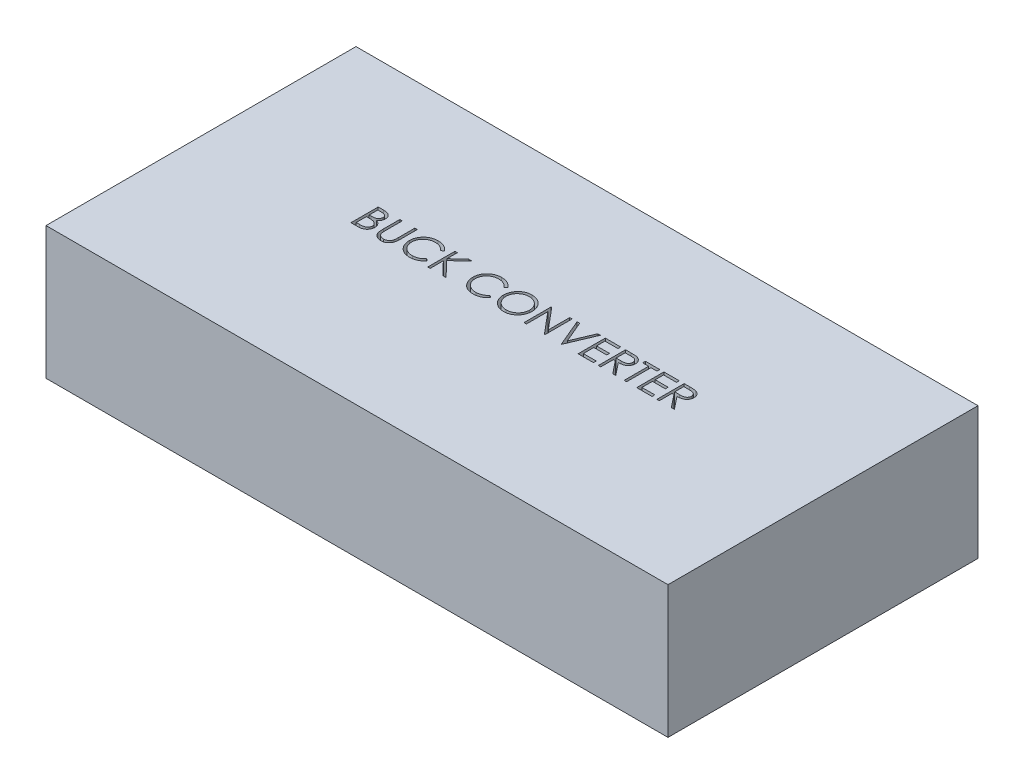
from build123d import *

# Parameters (mm, degrees)
SKETCH1_W           = 80.01
SKETCH1_H           = 39.878
BOSS_EXTRUDE1_DEPTH = 17.018
CUT_EXTRUDE2_DEPTH  = 12.7


with BuildPart() as part:
    # Sketch1 → Boss-Extrude1 (new body)
    with BuildSketch(Plane(origin=(0, 0, 0), x_dir=(1, 0, 0), z_dir=(0, 1, 0))):
        Rectangle(SKETCH1_W, SKETCH1_H)
    extrude(amount=BOSS_EXTRUDE1_DEPTH)

    # Sketch4 → Cut-Extrude2 (cut)
    # profile 1 of 13: a face of its own
    with BuildSketch(Plane(origin=(0, 17.018, 0), x_dir=(1, 0, 0), z_dir=(0, 1, 0))):
        with BuildLine():
            Line((-20.708333333, 3.5), (-20.025440705, 3.5))
            add(Edge.make_bspline(
                [(-20.025440705, 3.5), (-19.992012227, 3.49982425), (-19.927219517, 3.499483602), (-19.833000075, 3.49420047), (-19.744751264, 3.486996801), (-19.662447492, 3.475566708), (-19.586126789, 3.461774931), (-19.515559152, 3.445073115), (-19.45096898, 3.425046501), (-19.373856243, 3.39320022), (-19.285935583, 3.345877051), (-19.19073719, 3.275948486), (-19.109332951, 3.190416023), (-19.039146633, 3.093933368), (-18.983345514, 2.987797596), (-18.942976216, 2.874538407), (-18.917418341, 2.755616665), (-18.914789907, 2.673973487), (-18.913461538, 2.63271234)],
                knots=[0, 0, 0, 0, 1.001505555, 1.941167018, 2.826882275, 3.653841531, 4.429895133, 5.150066043, 5.825578002, 6.45369114, 7.647487171, 8.808567382, 9.977351308, 11.170798116, 12.373658725, 13.556498008, 14.765093433, 16, 16, 16, 16], degree=3))
            add(Edge.make_bspline(
                [(-18.913461538, 2.63271234), (-18.914554757, 2.594059784), (-18.916703034, 2.518103867), (-18.937245794, 2.407009758), (-18.969406462, 2.301258539), (-19.014111711, 2.201236154), (-19.072213707, 2.10920254), (-19.141072026, 2.024415274), (-19.224148829, 1.950464217), (-19.286392069, 1.909121315), (-19.318008814, 1.888120994)],
                knots=[0, 0, 0, 0, 1.044552857, 2.05264487, 3.044412934, 4.028983338, 5.005914585, 5.980388656, 6.974128949, 8, 8, 8, 8], degree=3))
            add(Edge.make_bspline(
                [(-19.318008814, 1.888120994), (-19.278248387, 1.872855995), (-19.202176839, 1.84365027), (-19.097490827, 1.792014806), (-19.007295982, 1.735852696), (-18.930898836, 1.674520846), (-18.865561181, 1.608412035), (-18.808508239, 1.536556921), (-18.759826865, 1.458018163), (-18.718113941, 1.373614627), (-18.685565185, 1.284208159), (-18.661189281, 1.190637383), (-18.647221832, 1.093237828), (-18.645234191, 1.026952448), (-18.644230769, 0.993489583)],
                knots=[0, 0, 0, 0, 1.27268992, 2.434971085, 3.483601985, 4.442670788, 5.356604649, 6.2567628, 7.179492994, 8.113709626, 9.066344395, 10.018646069, 10.999752585, 12, 12, 12, 12], degree=3))
            add(Edge.make_bspline(
                [(-18.644230769, 0.993489583), (-18.645207615, 0.959322711), (-18.647129587, 0.892098433), (-18.661309559, 0.793343299), (-18.685318666, 0.698968352), (-18.718389812, 0.608363169), (-18.761552127, 0.521703035), (-18.814080091, 0.438889771), (-18.876711655, 0.36075544), (-18.946774524, 0.286431817), (-19.026036669, 0.21960403), (-19.111552424, 0.160088323), (-19.204398744, 0.111142261), (-19.303050738, 0.070026239), (-19.408615054, 0.038619041), (-19.520617662, 0.016646467), (-19.638961963, 0.00184143), (-19.720171715, 0.000624225), (-19.76181891, 0)],
                knots=[0, 0, 0, 0, 0.978564426, 1.925352924, 2.850884081, 3.763762016, 4.682927383, 5.618979971, 6.567305752, 7.547517671, 8.540179244, 9.531824382, 10.526200242, 11.540722885, 12.589160233, 13.674978461, 14.80764778, 16, 16, 16, 16], degree=3))
            Line((-19.76181891, 0), (-20.708333333, 0))
            Line((-20.708333333, 0), (-20.708333333, 3.5))
        make_face()
        with BuildLine():
            Line((-20.394230769, 3.141025641), (-20.394230769, 2.019230769))
            Line((-20.394230769, 2.019230769), (-20.183193109, 2.019230769))
            add(Edge.make_bspline(
                [(-20.183193109, 2.019230769), (-20.152344314, 2.019630692), (-20.092738154, 2.020403425), (-20.006418258, 2.022616942), (-19.92629324, 2.028814985), (-19.852501407, 2.035011248), (-19.785158963, 2.045085835), (-19.724415101, 2.057077958), (-19.669316504, 2.069760863), (-19.605776959, 2.09133035), (-19.53370401, 2.123208025), (-19.456870906, 2.172679861), (-19.389136436, 2.231604215), (-19.331939249, 2.299595176), (-19.285127778, 2.374461362), (-19.252614063, 2.455008243), (-19.230566779, 2.539228375), (-19.228575247, 2.597046627), (-19.227564103, 2.626402244)],
                knots=[0, 0, 0, 0, 1.156816544, 2.235205308, 3.236616184, 4.169592532, 5.011045266, 5.787822928, 6.49130361, 7.128639758, 8.301311294, 9.436451833, 10.541879658, 11.654887649, 12.756523258, 13.837046038, 14.901820046, 16, 16, 16, 16], degree=3))
            add(Edge.make_bspline(
                [(-19.227564103, 2.626402244), (-19.228090283, 2.645828015), (-19.229122443, 2.683933787), (-19.237575745, 2.739483141), (-19.25194332, 2.791726894), (-19.270397613, 2.841381004), (-19.296186302, 2.886892854), (-19.326549765, 2.92983605), (-19.363235455, 2.968748169), (-19.404992768, 3.005117667), (-19.453001391, 3.037362195), (-19.507232683, 3.065602958), (-19.56842036, 3.088343735), (-19.635533215, 3.108259887), (-19.709604302, 3.122248181), (-19.789778856, 3.133901569), (-19.876713575, 3.139834311), (-19.936858677, 3.140619673), (-19.967948718, 3.141025641)],
                knots=[0, 0, 0, 0, 0.91205012, 1.789085906, 2.630437955, 3.453916878, 4.269457761, 5.079663411, 5.91843418, 6.774407191, 7.675494373, 8.627863946, 9.638891023, 10.736472738, 11.911756761, 13.175263542, 14.539845004, 16, 16, 16, 16], degree=3))
            Line((-19.967948718, 3.141025641), (-20.394230769, 3.141025641))
        make_face(mode=Mode.SUBTRACT)
        with BuildLine():
            Line((-20.394230769, 1.66025641), (-20.394230769, 0.358974359))
            Line((-20.394230769, 0.358974359), (-19.946915064, 0.358974359))
            add(Edge.make_bspline(
                [(-19.946915064, 0.358974359), (-19.914896138, 0.359358106), (-19.85318388, 0.360097729), (-19.764082649, 0.362512283), (-19.681499546, 0.368004559), (-19.60581141, 0.376650409), (-19.536200957, 0.386028858), (-19.473503254, 0.398640139), (-19.417210061, 0.413089099), (-19.351935753, 0.435423272), (-19.278432245, 0.470119743), (-19.199221388, 0.522433969), (-19.12879517, 0.584757277), (-19.068989911, 0.656888191), (-19.019976923, 0.735319518), (-18.984321467, 0.818464868), (-18.962330611, 0.904950395), (-18.959668441, 0.963917108), (-18.958333333, 0.993489583)],
                knots=[0, 0, 0, 0, 1.160039823, 2.235823828, 3.228722157, 4.157150951, 4.99529583, 5.772374946, 6.472645482, 7.099169577, 8.269452708, 9.405989375, 10.527446681, 11.663510218, 12.788923519, 13.866172445, 14.929861265, 16, 16, 16, 16], degree=3))
            add(Edge.make_bspline(
                [(-18.958333333, 0.993489583), (-18.958609438, 1.011982924), (-18.959157193, 1.048671306), (-18.967417808, 1.102587125), (-18.979431677, 1.154812998), (-18.994963111, 1.205490739), (-19.017582578, 1.253704115), (-19.043989123, 1.300406674), (-19.074950525, 1.345660154), (-19.123194691, 1.402872407), (-19.193366675, 1.46878942), (-19.293073451, 1.533326923), (-19.406445749, 1.58537473), (-19.488673242, 1.607474206), (-19.53114984, 1.618890224)],
                knots=[0, 0, 0, 0, 0.723448775, 1.435228256, 2.130040452, 2.821711965, 3.505591119, 4.210454504, 4.921174351, 5.648778258, 7.137944449, 8.670945889, 10.280296675, 12, 12, 12, 12], degree=3))
            add(Edge.make_bspline(
                [(-19.53114984, 1.618890224), (-19.548178936, 1.622345308), (-19.585101528, 1.629836643), (-19.645309108, 1.637744346), (-19.714044977, 1.644789406), (-19.791467855, 1.650000564), (-19.877675696, 1.655387107), (-19.972852614, 1.657481929), (-20.076609929, 1.659981189), (-20.148602301, 1.660162323), (-20.185997596, 1.66025641)],
                knots=[0, 0, 0, 0, 0.634451884, 1.375622551, 2.216452059, 3.157844607, 4.20941857, 5.370758133, 6.634282058, 8, 8, 8, 8], degree=3))
            Line((-20.185997596, 1.66025641), (-20.394230769, 1.66025641))
        make_face(mode=Mode.SUBTRACT)
    # profile 2 of 13: a face of its own
    with BuildSketch(Plane(origin=(0, 17.018, 0), x_dir=(1, 0, 0), z_dir=(0, 1, 0))):
        with BuildLine():
            Line((-17.926282051, 3.5), (-17.612179487, 3.5))
            Line((-17.612179487, 3.5), (-17.612179487, 1.402944712))
            add(Edge.make_bspline(
                [(-17.612179487, 1.402944712), (-17.612226231, 1.373263976), (-17.612314936, 1.316939665), (-17.611722422, 1.236771364), (-17.610063054, 1.165498905), (-17.609016894, 1.102847558), (-17.606689561, 1.04910481), (-17.604791514, 1.0039795), (-17.602350957, 0.967685297), (-17.599417839, 0.946504371), (-17.598157051, 0.93739984)],
                knots=[0, 0, 0, 0, 1.528628734, 2.90083645, 4.128790002, 5.200304208, 6.127813768, 6.898992206, 7.526736466, 8, 8, 8, 8], degree=3))
            add(Edge.make_bspline(
                [(-17.598157051, 0.93739984), (-17.592979592, 0.904553076), (-17.582916406, 0.840710347), (-17.557270028, 0.749802065), (-17.521452527, 0.667870607), (-17.479009485, 0.592359316), (-17.423076873, 0.525369956), (-17.356073338, 0.463658303), (-17.274895569, 0.409686499), (-17.184634964, 0.360335687), (-17.087349726, 0.320670604), (-16.98793846, 0.29067724), (-16.887895481, 0.27239834), (-16.820919316, 0.270281801), (-16.787660256, 0.269230769)],
                knots=[0, 0, 0, 0, 1.035780045, 2.013197591, 2.933192213, 3.817615948, 4.702609284, 5.640816605, 6.646850145, 7.73207398, 8.84249596, 9.914020372, 10.964143139, 12, 12, 12, 12], degree=3))
            add(Edge.make_bspline(
                [(-16.787660256, 0.269230769), (-16.759106516, 0.27030462), (-16.702163954, 0.272446118), (-16.617557523, 0.285707549), (-16.535157415, 0.309608115), (-16.454556735, 0.340447873), (-16.37900575, 0.381195464), (-16.308462308, 0.428266303), (-16.245498374, 0.48347718), (-16.188040376, 0.544577524), (-16.138005441, 0.613517324), (-16.094634299, 0.688795462), (-16.059108369, 0.771544809), (-16.041564844, 0.829699231), (-16.032552083, 0.859575321)],
                knots=[0, 0, 0, 0, 0.994687771, 1.983630487, 2.973142513, 3.978332533, 4.983357753, 5.956394766, 6.925816176, 7.893390482, 8.871859704, 9.88551698, 10.913711441, 12, 12, 12, 12], degree=3))
            add(Edge.make_bspline(
                [(-16.032552083, 0.859575321), (-16.029551958, 0.871923895), (-16.02286647, 0.899441495), (-16.016619425, 0.945962785), (-16.010112899, 1.000852149), (-16.005598329, 1.064503962), (-16.001197109, 1.136704935), (-15.998564036, 1.217831192), (-15.997347003, 1.307588153), (-15.996984323, 1.370225315), (-15.996794872, 1.402944712)],
                knots=[0, 0, 0, 0, 0.558680831, 1.244966039, 2.062412453, 2.990489873, 4.051219941, 5.244515665, 6.560634259, 8, 8, 8, 8], degree=3))
            Line((-15.996794872, 1.402944712), (-15.996794872, 3.5))
            Line((-15.996794872, 3.5), (-15.682692308, 3.5))
            Line((-15.682692308, 3.5), (-15.682692308, 1.386117788))
            add(Edge.make_bspline(
                [(-15.682692308, 1.386117788), (-15.682946428, 1.34801941), (-15.683442359, 1.273668107), (-15.687742936, 1.164716748), (-15.694599936, 1.061363766), (-15.704288024, 0.96359527), (-15.717125027, 0.871761111), (-15.731400247, 0.785056342), (-15.749579781, 0.70410335), (-15.770813182, 0.628270932), (-15.79508673, 0.556085419), (-15.826527878, 0.487576804), (-15.861952378, 0.420662404), (-15.903967031, 0.356354295), (-15.951178414, 0.294367742), (-16.004630094, 0.235078667), (-16.062554255, 0.177539621), (-16.125913815, 0.123226555), (-16.19366434, 0.073417878), (-16.265604298, 0.029620107), (-16.341181067, -0.007403511), (-16.420198194, -0.037879435), (-16.502689396, -0.060794034), (-16.588656756, -0.07786919), (-16.67829595, -0.087571487), (-16.739260606, -0.089013418), (-16.770132212, -0.08974359)],
                knots=[0, 0, 0, 0, 1.316592851, 2.569410997, 3.76748051, 4.895814652, 5.963796859, 6.97159953, 7.931736103, 8.829262218, 9.692595152, 10.560224239, 11.431080259, 12.30701507, 13.211635791, 14.121146779, 15.063487852, 16.031507147, 17.00238618, 17.966455255, 18.938106653, 19.907068911, 20.888905087, 21.893141452, 22.933117798, 24, 24, 24, 24], degree=3))
            add(Edge.make_bspline(
                [(-16.770132212, -0.08974359), (-16.803801314, -0.088958824), (-16.869859973, -0.087419118), (-16.96719804, -0.078596368), (-17.060512237, -0.061977973), (-17.150788114, -0.04081803), (-17.236796611, -0.011634292), (-17.319690055, 0.022463832), (-17.398048736, 0.064341093), (-17.473143865, 0.110934486), (-17.542968621, 0.163359124), (-17.607066024, 0.220499298), (-17.665541895, 0.281439675), (-17.717410591, 0.346840041), (-17.763531476, 0.416191748), (-17.803261689, 0.489690988), (-17.837374933, 0.567309304), (-17.8549815, 0.621262504), (-17.863882212, 0.64853766)],
                knots=[0, 0, 0, 0, 1.13879206, 2.234305948, 3.301075583, 4.341971843, 5.366689343, 6.369221514, 7.369726634, 8.367512178, 9.355451585, 10.318319045, 11.268648973, 12.207971039, 13.137398894, 14.081662264, 15.030215811, 16, 16, 16, 16], degree=3))
            add(Edge.make_bspline(
                [(-17.863882212, 0.64853766), (-17.86905937, 0.667170235), (-17.880288741, 0.707584704), (-17.892314039, 0.774471192), (-17.90242312, 0.85148611), (-17.911928679, 0.938634728), (-17.917537637, 1.035984595), (-17.922455075, 1.143493511), (-17.926316694, 1.261291472), (-17.926293922, 1.343345988), (-17.926282051, 1.386117788)],
                knots=[0, 0, 0, 0, 0.625038921, 1.35572334, 2.194682327, 3.136881307, 4.189498639, 5.346923369, 6.617055217, 8, 8, 8, 8], degree=3))
            Line((-17.926282051, 1.386117788), (-17.926282051, 3.5))
        make_face()
    # profile 3 of 13: a face of its own
    with BuildSketch(Plane(origin=(0, 17.018, 0), x_dir=(1, 0, 0), z_dir=(0, 1, 0))):
        with BuildLine():
            Line((-11.554487179, 2.857772436), (-11.829326923, 2.647435897))
            add(Edge.make_bspline(
                [(-11.829326923, 2.647435897), (-11.848932811, 2.670801867), (-11.887880258, 2.717218783), (-11.950539461, 2.782398327), (-12.015841104, 2.843463589), (-12.083760225, 2.900705469), (-12.155519344, 2.952122234), (-12.229380143, 3.000393337), (-12.306578188, 3.043661075), (-12.413329923, 3.096124061), (-12.552977771, 3.150870216), (-12.72877261, 3.196773448), (-12.912283709, 3.225994623), (-13.037481308, 3.229159465), (-13.101161859, 3.230769231)],
                knots=[0, 0, 0, 0, 0.757959112, 1.505699292, 2.245454638, 2.979532153, 3.711538275, 4.438200793, 5.171680507, 5.909471876, 7.393775596, 8.890124382, 10.418191784, 12, 12, 12, 12], degree=3))
            add(Edge.make_bspline(
                [(-13.101161859, 3.230769231), (-13.136245158, 3.230365268), (-13.206086151, 3.229561092), (-13.309734624, 3.218951967), (-13.411447676, 3.204040757), (-13.511159142, 3.181915434), (-13.6087421, 3.153942815), (-13.704834502, 3.120517401), (-13.798045102, 3.079162561), (-13.88966334, 3.033454301), (-13.977442551, 2.981826856), (-14.060497599, 2.925513504), (-14.138525567, 2.865144408), (-14.211588179, 2.800493302), (-14.279760128, 2.731851341), (-14.342547438, 2.658487), (-14.399732849, 2.580634826), (-14.452449874, 2.499321419), (-14.499662607, 2.414783627), (-14.539192486, 2.326708556), (-14.574197609, 2.236604453), (-14.601896851, 2.143453293), (-14.623821368, 2.047910527), (-14.638949031, 1.949719739), (-14.649437503, 1.849086059), (-14.650237679, 1.780876747), (-14.650641026, 1.746494391)],
                knots=[0, 0, 0, 0, 1.054917814, 2.100044995, 3.131103042, 4.146048494, 5.169673617, 6.183595914, 7.203665975, 8.234915748, 9.262203917, 10.264457458, 11.251630812, 12.227803204, 13.197192746, 14.159520551, 15.12972552, 16.100847026, 17.073214652, 18.039054194, 19.002613845, 19.979014051, 20.95965708, 21.949030935, 22.966165397, 24, 24, 24, 24], degree=3))
            add(Edge.make_bspline(
                [(-14.650641026, 1.746494391), (-14.649379207, 1.694763071), (-14.646901792, 1.593195486), (-14.624853458, 1.444424876), (-14.591348367, 1.301904202), (-14.54113279, 1.16652436), (-14.479213739, 1.036616002), (-14.400973128, 0.914377148), (-14.310356591, 0.797960584), (-14.206082171, 0.690117636), (-14.091676355, 0.591603911), (-13.968928444, 0.504853329), (-13.838144156, 0.432538447), (-13.700767526, 0.3723625), (-13.555741412, 0.326105772), (-13.403326609, 0.293541649), (-13.243854614, 0.272299468), (-13.134885214, 0.27026578), (-13.079427083, 0.269230769)],
                knots=[0, 0, 0, 0, 1.029171465, 2.020641659, 2.987623507, 3.938342917, 4.889210282, 5.84687017, 6.821220943, 7.821438502, 8.827599549, 9.822697543, 10.807740252, 11.797342354, 12.80366471, 13.83203677, 14.896651826, 16, 16, 16, 16], degree=3))
            add(Edge.make_bspline(
                [(-13.079427083, 0.269230769), (-13.018324394, 0.270919549), (-12.898059685, 0.274243472), (-12.721691659, 0.302402721), (-12.552855893, 0.348060638), (-12.391543307, 0.411958561), (-12.238208661, 0.495023849), (-12.092612, 0.595721726), (-11.95463043, 0.715010059), (-11.871659148, 0.806093187), (-11.829326923, 0.852564103)],
                knots=[0, 0, 0, 0, 1.028121516, 2.023589091, 2.998037872, 3.967518031, 4.937445131, 5.927275754, 6.942489185, 8, 8, 8, 8], degree=3))
            Line((-11.829326923, 0.852564103), (-11.554487179, 0.644330929))
            add(Edge.make_bspline(
                [(-11.554487179, 0.644330929), (-11.576605289, 0.615792478), (-11.620735565, 0.558852271), (-11.692193582, 0.478580562), (-11.767470879, 0.403076526), (-11.847126589, 0.332948905), (-11.930244381, 0.266794439), (-12.018316693, 0.206492608), (-12.110185725, 0.151201724), (-12.205540204, 0.100574799), (-12.304278817, 0.055657552), (-12.406283252, 0.017203784), (-12.511113828, -0.015921105), (-12.618775336, -0.043173042), (-12.729491093, -0.064444126), (-12.842861567, -0.078663801), (-12.959131442, -0.088405715), (-13.037572863, -0.089293631), (-13.077323718, -0.08974359)],
                knots=[0, 0, 0, 0, 0.986787822, 1.968848986, 2.935600012, 3.899624008, 4.868462664, 5.837806735, 6.815139263, 7.798259679, 8.787526145, 9.778297419, 10.776456485, 11.791383307, 12.812564526, 13.85620153, 14.913611965, 16, 16, 16, 16], degree=3))
            add(Edge.make_bspline(
                [(-13.077323718, -0.08974359), (-13.114967385, -0.089481597), (-13.189403075, -0.088963539), (-13.299301827, -0.080571372), (-13.406291408, -0.069121635), (-13.510066033, -0.051881504), (-13.611192008, -0.031537164), (-13.708752593, -0.004265907), (-13.803707803, 0.026283259), (-13.895676144, 0.062188246), (-13.984735844, 0.102704429), (-14.070599655, 0.148495987), (-14.153228088, 0.199177852), (-14.233433508, 0.253632863), (-14.310031092, 0.313610164), (-14.383684617, 0.378276799), (-14.454807094, 0.44741481), (-14.498809779, 0.497269663), (-14.520933494, 0.522335737)],
                knots=[0, 0, 0, 0, 1.114604814, 2.203992996, 3.262667896, 4.300477797, 5.318619304, 6.316056647, 7.298880507, 8.271930387, 9.238335007, 10.195173496, 11.151986948, 12.108099108, 13.064862484, 14.031167946, 15.010108607, 16, 16, 16, 16], degree=3))
            add(Edge.make_bspline(
                [(-14.520933494, 0.522335737), (-14.556369137, 0.565876926), (-14.626812614, 0.652433637), (-14.716938297, 0.792719618), (-14.794085853, 0.939187827), (-14.856461773, 1.092607755), (-14.905224507, 1.252635143), (-14.939005702, 1.419350657), (-14.960957306, 1.592598599), (-14.963467595, 1.710435388), (-14.96474359, 1.770332532)],
                knots=[0, 0, 0, 0, 0.994628077, 1.977248131, 2.950237994, 3.925870899, 4.908910175, 5.911660606, 6.938484602, 8, 8, 8, 8], degree=3))
            add(Edge.make_bspline(
                [(-14.96474359, 1.770332532), (-14.963188396, 1.833287986), (-14.96012865, 1.95714891), (-14.934132854, 2.138922863), (-14.892314058, 2.313074262), (-14.83291717, 2.479278007), (-14.757611818, 2.638408287), (-14.664585205, 2.789249492), (-14.554918062, 2.932766292), (-14.429470495, 3.066781043), (-14.291903159, 3.189320396), (-14.144584345, 3.297126599), (-13.987802398, 3.386844115), (-13.823284547, 3.461840278), (-13.649798865, 3.519484741), (-13.467715496, 3.559837928), (-13.277376581, 3.584955044), (-13.147514156, 3.588130252), (-13.081530449, 3.58974359)],
                knots=[0, 0, 0, 0, 1.032925535, 2.032216505, 3.007276963, 3.968222605, 4.92396291, 5.891752235, 6.871517503, 7.883894988, 8.900124299, 9.891468569, 10.874487609, 11.85992873, 12.854644235, 13.869047385, 14.917252991, 16, 16, 16, 16], degree=3))
            add(Edge.make_bspline(
                [(-13.081530449, 3.58974359), (-13.041315977, 3.589261452), (-12.961715479, 3.588307108), (-12.843962827, 3.579000965), (-12.7293205, 3.563487359), (-12.617709518, 3.542371289), (-12.508586902, 3.516163968), (-12.402786661, 3.48202367), (-12.299687974, 3.442987138), (-12.199941066, 3.398028672), (-12.104024516, 3.347561931), (-12.011968197, 3.292146307), (-11.924503339, 3.231850502), (-11.84101449, 3.167187326), (-11.762898279, 3.096788767), (-11.687936801, 3.022591171), (-11.618675722, 2.942457347), (-11.575922527, 2.886052413), (-11.554487179, 2.857772436)],
                knots=[0, 0, 0, 0, 1.096760587, 2.17092713, 3.219439832, 4.250915756, 5.268269357, 6.278326846, 7.281116186, 8.274029601, 9.260640565, 10.235837813, 11.203064059, 12.156899882, 13.114053108, 14.069676657, 15.032185724, 16, 16, 16, 16], degree=3))
        make_face()
    # profile 4 of 13: a face of its own
    with BuildSketch(Plane(origin=(0, 17.018, 0), x_dir=(1, 0, 0), z_dir=(0, 1, 0))):
        Polygon((-10.836538462, 3.5), (-10.522435897, 3.5), (-10.522435897, 2.167167468), (-9.063401442, 3.5), (-8.615384615, 3.5), (-10.335236378, 1.929487179), (-8.480769231, 0), (-8.899338942, 0), (-10.522435897, 1.689002404), (-10.522435897, 0), (-10.836538462, 0), align=None)
    # profile 5 of 13: a face of its own
    with BuildSketch(Plane(origin=(0, 17.018, 0), x_dir=(1, 0, 0), z_dir=(0, 1, 0))):
        with BuildLine():
            Line((-3.387820513, 2.857772436), (-3.662660256, 2.647435897))
            add(Edge.make_bspline(
                [(-3.662660256, 2.647435897), (-3.682266145, 2.670801867), (-3.721213592, 2.717218783), (-3.783872794, 2.782398327), (-3.849174437, 2.843463589), (-3.917093558, 2.900705469), (-3.988852678, 2.952122234), (-4.062713476, 3.000393337), (-4.139911522, 3.043661075), (-4.246663256, 3.096124061), (-4.386311105, 3.150870216), (-4.562105944, 3.196773448), (-4.745617042, 3.225994623), (-4.870814642, 3.229159465), (-4.934495192, 3.230769231)],
                knots=[0, 0, 0, 0, 0.757959112, 1.505699292, 2.245454638, 2.979532153, 3.711538275, 4.438200793, 5.171680507, 5.909471876, 7.393775596, 8.890124382, 10.418191784, 12, 12, 12, 12], degree=3))
            add(Edge.make_bspline(
                [(-4.934495192, 3.230769231), (-4.969578492, 3.230365268), (-5.039419484, 3.229561092), (-5.143067958, 3.218951967), (-5.244781009, 3.204040757), (-5.344492475, 3.181915434), (-5.442075434, 3.153942815), (-5.538167836, 3.120517401), (-5.631378435, 3.079162561), (-5.722996674, 3.033454301), (-5.810775885, 2.981826856), (-5.893830932, 2.925513504), (-5.9718589, 2.865144408), (-6.044921513, 2.800493302), (-6.113093461, 2.731851341), (-6.175880772, 2.658487), (-6.233066182, 2.580634826), (-6.285783207, 2.499321419), (-6.33299594, 2.414783627), (-6.37252582, 2.326708556), (-6.407530942, 2.236604453), (-6.435230185, 2.143453293), (-6.457154701, 2.047910527), (-6.472282365, 1.949719739), (-6.482770836, 1.849086059), (-6.483571013, 1.780876747), (-6.483974359, 1.746494391)],
                knots=[0, 0, 0, 0, 1.054917814, 2.100044995, 3.131103042, 4.146048494, 5.169673617, 6.183595914, 7.203665975, 8.234915748, 9.262203917, 10.264457458, 11.251630812, 12.227803204, 13.197192746, 14.159520551, 15.12972552, 16.100847026, 17.073214652, 18.039054194, 19.002613845, 19.979014051, 20.95965708, 21.949030935, 22.966165397, 24, 24, 24, 24], degree=3))
            add(Edge.make_bspline(
                [(-6.483974359, 1.746494391), (-6.48271254, 1.694763071), (-6.480235126, 1.593195486), (-6.458186792, 1.444424876), (-6.4246817, 1.301904202), (-6.374466123, 1.16652436), (-6.312547073, 1.036616002), (-6.234306461, 0.914377148), (-6.143689924, 0.797960584), (-6.039415504, 0.690117636), (-5.925009688, 0.591603911), (-5.802261777, 0.504853329), (-5.671477489, 0.432538447), (-5.534100859, 0.3723625), (-5.389074745, 0.326105772), (-5.236659943, 0.293541649), (-5.077187947, 0.272299468), (-4.968218547, 0.27026578), (-4.912760417, 0.269230769)],
                knots=[0, 0, 0, 0, 1.029171465, 2.020641659, 2.987623507, 3.938342917, 4.889210282, 5.84687017, 6.821220943, 7.821438502, 8.827599549, 9.822697543, 10.807740252, 11.797342354, 12.80366471, 13.83203677, 14.896651826, 16, 16, 16, 16], degree=3))
            add(Edge.make_bspline(
                [(-4.912760417, 0.269230769), (-4.851657728, 0.270919549), (-4.731393019, 0.274243472), (-4.555024992, 0.302402721), (-4.386189227, 0.348060638), (-4.22487664, 0.411958561), (-4.071541994, 0.495023849), (-3.925945334, 0.595721726), (-3.787963763, 0.715010059), (-3.704992481, 0.806093187), (-3.662660256, 0.852564103)],
                knots=[0, 0, 0, 0, 1.028121516, 2.023589091, 2.998037872, 3.967518031, 4.937445131, 5.927275754, 6.942489185, 8, 8, 8, 8], degree=3))
            Line((-3.662660256, 0.852564103), (-3.387820513, 0.644330929))
            add(Edge.make_bspline(
                [(-3.387820513, 0.644330929), (-3.409938623, 0.615792478), (-3.454068898, 0.558852271), (-3.525526915, 0.478580562), (-3.600804212, 0.403076526), (-3.680459922, 0.332948905), (-3.763577714, 0.266794439), (-3.851650026, 0.206492608), (-3.943519059, 0.151201724), (-4.038873538, 0.100574799), (-4.137612151, 0.055657552), (-4.239616585, 0.017203784), (-4.344447161, -0.015921105), (-4.452108669, -0.043173042), (-4.562824426, -0.064444126), (-4.6761949, -0.078663801), (-4.792464775, -0.088405715), (-4.870906197, -0.089293631), (-4.910657051, -0.08974359)],
                knots=[0, 0, 0, 0, 0.986787822, 1.968848986, 2.935600012, 3.899624008, 4.868462664, 5.837806735, 6.815139263, 7.798259679, 8.787526145, 9.778297419, 10.776456485, 11.791383307, 12.812564526, 13.85620153, 14.913611965, 16, 16, 16, 16], degree=3))
            add(Edge.make_bspline(
                [(-4.910657051, -0.08974359), (-4.948300718, -0.089481597), (-5.022736408, -0.088963539), (-5.13263516, -0.080571372), (-5.239624741, -0.069121635), (-5.343399367, -0.051881504), (-5.444525342, -0.031537164), (-5.542085926, -0.004265907), (-5.637041137, 0.026283259), (-5.729009477, 0.062188246), (-5.818069177, 0.102704429), (-5.903932988, 0.148495987), (-5.986561421, 0.199177852), (-6.066766842, 0.253632863), (-6.143364425, 0.313610164), (-6.217017951, 0.378276799), (-6.288140427, 0.44741481), (-6.332143112, 0.497269663), (-6.354266827, 0.522335737)],
                knots=[0, 0, 0, 0, 1.114604814, 2.203992996, 3.262667896, 4.300477797, 5.318619304, 6.316056647, 7.298880507, 8.271930387, 9.238335007, 10.195173496, 11.151986948, 12.108099108, 13.064862484, 14.031167946, 15.010108607, 16, 16, 16, 16], degree=3))
            add(Edge.make_bspline(
                [(-6.354266827, 0.522335737), (-6.38970247, 0.565876926), (-6.460145947, 0.652433637), (-6.550271631, 0.792719618), (-6.627419186, 0.939187827), (-6.689795107, 1.092607755), (-6.73855784, 1.252635143), (-6.772339035, 1.419350657), (-6.79429064, 1.592598599), (-6.796800928, 1.710435388), (-6.798076923, 1.770332532)],
                knots=[0, 0, 0, 0, 0.994628077, 1.977248131, 2.950237994, 3.925870899, 4.908910175, 5.911660606, 6.938484602, 8, 8, 8, 8], degree=3))
            add(Edge.make_bspline(
                [(-6.798076923, 1.770332532), (-6.79652173, 1.833287986), (-6.793461983, 1.95714891), (-6.767466188, 2.138922863), (-6.725647392, 2.313074262), (-6.666250503, 2.479278007), (-6.590945152, 2.638408287), (-6.497918538, 2.789249492), (-6.388251396, 2.932766292), (-6.262803828, 3.066781043), (-6.125236493, 3.189320396), (-5.977917679, 3.297126599), (-5.821135732, 3.386844115), (-5.65661788, 3.461840278), (-5.483132199, 3.519484741), (-5.301048829, 3.559837928), (-5.110709915, 3.584955044), (-4.980847489, 3.588130252), (-4.914863782, 3.58974359)],
                knots=[0, 0, 0, 0, 1.032925535, 2.032216505, 3.007276963, 3.968222605, 4.92396291, 5.891752235, 6.871517503, 7.883894988, 8.900124299, 9.891468569, 10.874487609, 11.85992873, 12.854644235, 13.869047385, 14.917252991, 16, 16, 16, 16], degree=3))
            add(Edge.make_bspline(
                [(-4.914863782, 3.58974359), (-4.87464931, 3.589261452), (-4.795048813, 3.588307108), (-4.67729616, 3.579000965), (-4.562653833, 3.563487359), (-4.451042851, 3.542371289), (-4.341920235, 3.516163968), (-4.236119994, 3.48202367), (-4.133021307, 3.442987138), (-4.033274399, 3.398028672), (-3.937357849, 3.347561931), (-3.845301531, 3.292146307), (-3.757836672, 3.231850502), (-3.674347824, 3.167187326), (-3.596231612, 3.096788767), (-3.521270134, 3.022591171), (-3.452009056, 2.942457347), (-3.409255861, 2.886052413), (-3.387820513, 2.857772436)],
                knots=[0, 0, 0, 0, 1.096760587, 2.17092713, 3.219439832, 4.250915756, 5.268269357, 6.278326846, 7.281116186, 8.274029601, 9.260640565, 10.235837813, 11.203064059, 12.156899882, 13.114053108, 14.069676657, 15.032185724, 16, 16, 16, 16], degree=3))
        make_face()
    # profile 6 of 13: a face of its own
    with BuildSketch(Plane(origin=(0, 17.018, 0), x_dir=(1, 0, 0), z_dir=(0, 1, 0))):
        with BuildLine():
            add(Edge.make_bspline(
                [(-1.032051282, 3.58974359), (-0.967243176, 3.58810211), (-0.839954709, 3.584878109), (-0.652879811, 3.560199006), (-0.474284716, 3.517503616), (-0.302714577, 3.460640633), (-0.140221601, 3.384786248), (0.014417292, 3.2931011), (0.160834166, 3.184624641), (0.297055547, 3.060195414), (0.421712497, 2.92481196), (0.531538384, 2.78033405), (0.623580677, 2.627635248), (0.699166464, 2.467174417), (0.758465074, 2.299314449), (0.799384118, 2.123160446), (0.825522268, 1.939853756), (0.828578045, 1.814826892), (0.830128205, 1.751402244)],
                knots=[0, 0, 0, 0, 1.065120563, 2.091984664, 3.0946048, 4.079830382, 5.057816894, 6.036188127, 7.030412546, 8.04752943, 9.064399622, 10.05169764, 11.02544977, 11.989514704, 12.962713494, 13.945757189, 14.957906945, 16, 16, 16, 16], degree=3))
            add(Edge.make_bspline(
                [(0.830128205, 1.751402244), (0.828578273, 1.688444797), (0.825523176, 1.564348377), (0.799354399, 1.382204933), (0.758313399, 1.207114236), (0.699717132, 1.039368583), (0.624491654, 0.87879102), (0.531836483, 0.725804066), (0.422695272, 0.580357567), (0.298488421, 0.444044902), (0.163087379, 0.319047431), (0.017857112, 0.210128556), (-0.133936208, 0.116404431), (-0.294245916, 0.041620757), (-0.460945953, -0.018151163), (-0.635528276, -0.058903793), (-0.81717483, -0.085190837), (-0.941045834, -0.088209353), (-1.00400641, -0.08974359)],
                knots=[0, 0, 0, 0, 1.043624062, 2.057103931, 3.04512605, 4.022047818, 4.998200453, 5.980619268, 6.982898556, 8.009068085, 9.034988726, 10.034168286, 11.015286542, 11.987931943, 12.962482838, 13.94673481, 14.956375938, 16, 16, 16, 16], degree=3))
            add(Edge.make_bspline(
                [(-1.00400641, -0.08974359), (-1.067430729, -0.088194203), (-1.192456945, -0.085139949), (-1.375993981, -0.058958544), (-1.552271724, -0.01801724), (-1.720786076, 0.040492196), (-1.881631005, 0.116109427), (-2.035121088, 0.208313806), (-2.180640235, 0.317720947), (-2.316981982, 0.441887521), (-2.44173118, 0.577059073), (-2.550490556, 0.721893329), (-2.642715669, 0.873548785), (-2.718079001, 1.032446309), (-2.777743461, 1.197817752), (-2.818448279, 1.370766229), (-2.844784231, 1.550305735), (-2.847819077, 1.672548634), (-2.849358974, 1.734575321)],
                knots=[0, 0, 0, 0, 1.053102029, 2.075944431, 3.073151272, 4.055350789, 5.033113405, 6.020478099, 7.024410459, 8.052272461, 9.079885166, 10.07527673, 11.055994387, 12.023226415, 12.992069828, 13.970394897, 14.97016774, 16, 16, 16, 16], degree=3))
            add(Edge.make_bspline(
                [(-2.849358974, 1.734575321), (-2.848824339, 1.77620799), (-2.847761813, 1.858948113), (-2.83497012, 1.981814713), (-2.816408419, 2.102705371), (-2.789806506, 2.221276319), (-2.755014839, 2.337237304), (-2.713962812, 2.451388067), (-2.663822967, 2.56257179), (-2.607142319, 2.671315182), (-2.54388051, 2.775923088), (-2.474004761, 2.874802671), (-2.399969393, 2.968783668), (-2.318805999, 3.055430672), (-2.233189554, 3.137264328), (-2.141731176, 3.213027045), (-2.044988931, 3.283401996), (-1.942546551, 3.346822337), (-1.836928277, 3.404181472), (-1.728051499, 3.453403323), (-1.617394927, 3.495649384), (-1.504440279, 3.529890209), (-1.389487507, 3.556922245), (-1.272285723, 3.575329599), (-1.152928296, 3.588153917), (-1.072516978, 3.589211419), (-1.032051282, 3.58974359)],
                knots=[0, 0, 0, 0, 1.037015668, 2.060948919, 3.074880161, 4.083647147, 5.086022904, 6.090072063, 7.104153813, 8.122640571, 9.144368836, 10.147691507, 11.138137339, 12.123020368, 13.103399296, 14.087645067, 15.080126199, 16.082011238, 17.087798457, 18.072939717, 19.057185487, 20.037253025, 21.01195951, 21.997135196, 22.992090687, 24, 24, 24, 24], degree=3))
        make_face()
        with BuildLine():
            add(Edge.make_bspline(
                [(-1.016626603, 3.230769231), (-1.049841236, 3.230364341), (-1.115952969, 3.229558431), (-1.214237505, 3.218942715), (-1.311229439, 3.203812826), (-1.406948801, 3.182231305), (-1.500995091, 3.152827253), (-1.594244932, 3.118986345), (-1.685847986, 3.077765254), (-1.775501844, 3.03119255), (-1.862416919, 2.979643629), (-1.94442962, 2.922671862), (-2.021752264, 2.861613307), (-2.094195531, 2.79632547), (-2.161546703, 2.726475868), (-2.225131404, 2.653123432), (-2.282400986, 2.574171541), (-2.334886563, 2.491761134), (-2.381854403, 2.405999553), (-2.423619758, 2.317789691), (-2.457783767, 2.226412004), (-2.485646143, 2.132857846), (-2.508745954, 2.037275387), (-2.523379878, 1.938939538), (-2.534112237, 1.838344426), (-2.534872083, 1.770362572), (-2.53525641, 1.735977564)],
                knots=[0, 0, 0, 0, 1.008559885, 2.007477868, 2.99961109, 3.989939068, 4.984837346, 5.991145699, 7.001802488, 8.033829008, 9.059044045, 10.069351652, 11.065060232, 12.050310815, 13.029377138, 14.011219647, 14.996725999, 15.989392538, 16.977580475, 17.965360261, 18.951710183, 19.937753436, 20.929683414, 21.935841486, 22.955955122, 24, 24, 24, 24], degree=3))
            add(Edge.make_bspline(
                [(-2.53525641, 1.735977564), (-2.533981548, 1.685415343), (-2.5314735, 1.585943813), (-2.50951593, 1.440175669), (-2.475693956, 1.300087383), (-2.425836589, 1.166445474), (-2.363485975, 1.038101191), (-2.286459084, 0.916193086), (-2.195199999, 0.800688212), (-2.091536472, 0.692392943), (-1.978213766, 0.593547138), (-1.857881036, 0.50678373), (-1.731827428, 0.43337348), (-1.599724226, 0.373568408), (-1.462276687, 0.32617867), (-1.318599136, 0.293700039), (-1.169648676, 0.272324583), (-1.068118021, 0.270271827), (-1.016626603, 0.269230769)],
                knots=[0, 0, 0, 0, 1.032063989, 2.030389145, 3.003944642, 3.970395727, 4.937377036, 5.913328081, 6.909231446, 7.93887556, 8.970685674, 9.976071282, 10.964166581, 11.944589148, 12.933237628, 13.927779006, 14.949070134, 16, 16, 16, 16], degree=3))
            add(Edge.make_bspline(
                [(-1.016626603, 0.269230769), (-0.982017101, 0.269706274), (-0.913376065, 0.270649342), (-0.811280542, 0.280148018), (-0.71102433, 0.295379888), (-0.612748051, 0.317310543), (-0.516563239, 0.34475775), (-0.422068436, 0.377365478), (-0.330270146, 0.418046682), (-0.240010308, 0.462994633), (-0.153614066, 0.514234791), (-0.071138534, 0.56927294), (0.005337446, 0.630241561), (0.077726517, 0.694559374), (0.145354206, 0.763523221), (0.20776319, 0.837043443), (0.264743323, 0.9155841), (0.317208969, 0.997869506), (0.364012232, 1.083865759), (0.404791331, 1.172395437), (0.439387447, 1.263240546), (0.467315952, 1.356532118), (0.489201413, 1.452092966), (0.504281333, 1.550051045), (0.514829772, 1.650210387), (0.515624849, 1.717954243), (0.516025641, 1.752103365)],
                knots=[0, 0, 0, 0, 1.047197238, 2.076906641, 3.100256066, 4.114471768, 5.12198147, 6.126382909, 7.136867548, 8.15857795, 9.17633901, 10.174870724, 11.156907918, 12.133735059, 13.104061851, 14.077631395, 15.04955518, 16.038496417, 17.029181396, 18.010275684, 18.986308667, 19.968651475, 20.955262928, 21.950658345, 22.966943676, 24, 24, 24, 24], degree=3))
            add(Edge.make_bspline(
                [(0.516025641, 1.752103365), (0.515624528, 1.78601887), (0.514828847, 1.85329652), (0.504286372, 1.952757338), (0.489185482, 2.05001055), (0.467422774, 2.144674353), (0.43937262, 2.236772878), (0.404785289, 2.326219625), (0.36399999, 2.413347821), (0.317191766, 2.497942118), (0.264575942, 2.579116855), (0.207081699, 2.656719268), (0.143716351, 2.729292009), (0.076290326, 2.798626703), (0.00311944, 2.863244593), (-0.075464854, 2.923167114), (-0.158508531, 2.979840388), (-0.246435767, 3.03096595), (-0.337179721, 3.078180182), (-0.430293679, 3.118631186), (-0.524722778, 3.153003305), (-0.620226891, 3.18232027), (-0.717609869, 3.2037283), (-0.816213698, 3.21895635), (-0.915901956, 3.229554736), (-0.982945176, 3.230363114), (-1.016626603, 3.230769231)],
                knots=[0, 0, 0, 0, 1.02996197, 2.043119294, 3.035359645, 4.018872909, 4.991431989, 5.957985074, 6.929999688, 7.912076566, 8.892894881, 9.867085534, 10.843653904, 11.817741046, 12.803660682, 13.806313499, 14.818574707, 15.856120519, 16.894564902, 17.924820532, 18.937903209, 19.946497019, 20.957711757, 21.963978472, 22.977135795, 24, 24, 24, 24], degree=3))
        make_face(mode=Mode.SUBTRACT)
    # profile 7 of 13: a face of its own
    with BuildSketch(Plane(origin=(0, 17.018, 0), x_dir=(1, 0, 0), z_dir=(0, 1, 0))):
        Polygon((1.548076923, 0), (1.548076923, 3.5), (1.613982372, 3.5), (3.926282051, 0.745292468), (3.926282051, 3.5), (4.240384615, 3.5), (4.240384615, 0), (4.168870192, 0), (1.862179487, 2.748397436), (1.862179487, 0), align=None)
    # profile 8 of 13: a face of its own
    with BuildSketch(Plane(origin=(0, 17.018, 0), x_dir=(1, 0, 0), z_dir=(0, 1, 0))):
        Polygon((4.868589744, 3.5), (5.205128205, 3.5), (6.371794872, 0.741786859), (7.538461538, 3.5), (7.875, 3.5), (6.394230769, 0), (6.349358974, 0), align=None)
    # profile 9 of 13: a face of its own
    with BuildSketch(Plane(origin=(0, 17.018, 0), x_dir=(1, 0, 0), z_dir=(0, 1, 0))):
        Polygon((8.503205128, 3.5), (10.477564103, 3.5), (10.477564103, 3.141025641), (8.817307692, 3.141025641), (8.817307692, 2.064102564), (10.477564103, 2.064102564), (10.477564103, 1.705128205), (8.817307692, 1.705128205), (8.817307692, 0.358974359), (10.477564103, 0.358974359), (10.477564103, 0), (8.503205128, 0), align=None)
    # profile 10 of 13: a face of its own
    with BuildSketch(Plane(origin=(0, 17.018, 0), x_dir=(1, 0, 0), z_dir=(0, 1, 0))):
        with BuildLine():
            Line((11.105769231, 3.5), (11.806189904, 3.5))
            add(Edge.make_bspline(
                [(11.806189904, 3.5), (11.852931032, 3.499844414), (11.942679177, 3.499545672), (12.071252447, 3.497879909), (12.188079544, 3.493105553), (12.293099383, 3.48899697), (12.386310038, 3.481505028), (12.467997329, 3.474344381), (12.537785027, 3.46497072), (12.580030878, 3.456265297), (12.599158654, 3.452323718)],
                knots=[0, 0, 0, 0, 1.410062039, 2.707475311, 3.878576406, 4.937260626, 5.877586885, 6.699081471, 7.410979367, 8, 8, 8, 8], degree=3))
            add(Edge.make_bspline(
                [(12.599158654, 3.452323718), (12.624765278, 3.445996953), (12.675432267, 3.433478389), (12.748382333, 3.407018788), (12.817896657, 3.376399163), (12.883686482, 3.340435443), (12.945422273, 3.298860663), (13.003740584, 3.252392541), (13.058906047, 3.201285335), (13.108687677, 3.144250494), (13.155626729, 3.084413984), (13.195215356, 3.019710227), (13.229341835, 2.9520487), (13.256512352, 2.880741282), (13.278390326, 2.80647951), (13.293816565, 2.728590713), (13.303067753, 2.647429738), (13.304009608, 2.59207183), (13.304487179, 2.564002404)],
                knots=[0, 0, 0, 0, 1.027469482, 2.033020251, 3.019912614, 3.986113645, 4.951240523, 5.91722682, 6.890402269, 7.87763091, 8.8651537, 9.85103654, 10.82876324, 11.815024772, 12.821070561, 13.842952187, 14.906261191, 16, 16, 16, 16], degree=3))
            add(Edge.make_bspline(
                [(13.304487179, 2.564002404), (13.303018181, 2.517367299), (13.300151786, 2.426370131), (13.273426682, 2.29430925), (13.229650162, 2.171119935), (13.169326873, 2.056957297), (13.092507397, 1.954046652), (13.000182606, 1.863656197), (12.892300995, 1.788016284), (12.791871679, 1.735563479), (12.703157479, 1.701970571), (12.630124166, 1.678334212), (12.550457189, 1.660072247), (12.464919854, 1.643712115), (12.373156199, 1.63136042), (12.275386159, 1.622313826), (12.171540008, 1.616659777), (12.100200938, 1.615817772), (12.063501603, 1.615384615)],
                knots=[0, 0, 0, 0, 1.260483769, 2.459530307, 3.627416485, 4.787058657, 5.939039949, 7.08810263, 8.267026773, 9.491475466, 10.141966685, 10.831826277, 11.566392101, 12.351337768, 13.187381173, 14.07005841, 15.007169909, 16, 16, 16, 16], degree=3))
            Line((12.063501603, 1.615384615), (13.349358974, 0))
            Line((13.349358974, 0), (12.9609375, 0))
            Line((12.9609375, 0), (11.675080128, 1.615384615))
            Line((11.675080128, 1.615384615), (11.419871795, 1.615384615))
            Line((11.419871795, 1.615384615), (11.419871795, 0))
            Line((11.419871795, 0), (11.105769231, 0))
            Line((11.105769231, 0), (11.105769231, 3.5))
        make_face()
        with BuildLine():
            Line((11.419871795, 3.141025641), (11.419871795, 1.974358974))
            Line((11.419871795, 1.974358974), (12.060697115, 1.969451122))
            add(Edge.make_bspline(
                [(12.060697115, 1.969451122), (12.090617154, 1.969437885), (12.148610711, 1.969412229), (12.232511376, 1.973406005), (12.310631488, 1.977949323), (12.38267224, 1.984898669), (12.448665815, 1.99385474), (12.508579229, 2.005057725), (12.562510281, 2.018109787), (12.625408819, 2.038311413), (12.69564535, 2.070317431), (12.77197681, 2.11688293), (12.836979148, 2.175452049), (12.89189701, 2.242425505), (12.936026442, 2.316061754), (12.967138496, 2.395478123), (12.986880938, 2.478669721), (12.989209484, 2.535847829), (12.990384615, 2.564703526)],
                knots=[0, 0, 0, 0, 1.146690395, 2.22261258, 3.21895312, 4.145990853, 4.996080663, 5.770904154, 6.481378293, 7.121626537, 8.300444488, 9.431385265, 10.535395872, 11.636531494, 12.74115979, 13.810798291, 14.895190096, 16, 16, 16, 16], degree=3))
            add(Edge.make_bspline(
                [(12.990384615, 2.564703526), (12.989182494, 2.592850099), (12.986800329, 2.648626338), (12.96735156, 2.730282248), (12.934462179, 2.807349198), (12.890139941, 2.879513683), (12.836140786, 2.945019419), (12.772822973, 3.001066572), (12.701917778, 3.047316037), (12.63564658, 3.076870418), (12.576412367, 3.094990271), (12.524982707, 3.107741435), (12.46687123, 3.117985904), (12.401795771, 3.126193964), (12.33003414, 3.133248909), (12.251223489, 3.138000687), (12.165886709, 3.140814551), (12.106739778, 3.14095364), (12.076121795, 3.141025641)],
                knots=[0, 0, 0, 0, 1.101028733, 2.181837193, 3.264309656, 4.369019818, 5.486613113, 6.575447106, 7.666700264, 8.788928104, 9.402425223, 10.0903467, 10.862060571, 11.710948788, 12.657782767, 13.684531032, 14.801375019, 16, 16, 16, 16], degree=3))
            Line((12.076121795, 3.141025641), (11.419871795, 3.141025641))
        make_face(mode=Mode.SUBTRACT)
    # profile 11 of 13: a face of its own
    with BuildSketch(Plane(origin=(0, 17.018, 0), x_dir=(1, 0, 0), z_dir=(0, 1, 0))):
        Polygon((13.663461538, 3.141025641), (13.663461538, 3.5), (15.503205128, 3.5), (15.503205128, 3.141025641), (14.740384615, 3.141025641), (14.740384615, 0), (14.426282051, 0), (14.426282051, 3.141025641), align=None)
    # profile 12 of 13: a face of its own
    with BuildSketch(Plane(origin=(0, 17.018, 0), x_dir=(1, 0, 0), z_dir=(0, 1, 0))):
        Polygon((16.041666667, 3.5), (18.016025641, 3.5), (18.016025641, 3.141025641), (16.355769231, 3.141025641), (16.355769231, 2.064102564), (18.016025641, 2.064102564), (18.016025641, 1.705128205), (16.355769231, 1.705128205), (16.355769231, 0.358974359), (18.016025641, 0.358974359), (18.016025641, 0), (16.041666667, 0), align=None)
    # profile 13 of 13: a face of its own
    with BuildSketch(Plane(origin=(0, 17.018, 0), x_dir=(1, 0, 0), z_dir=(0, 1, 0))):
        with BuildLine():
            Line((18.644230769, 3.5), (19.344651442, 3.5))
            add(Edge.make_bspline(
                [(19.344651442, 3.5), (19.391392571, 3.499844414), (19.481140715, 3.499545672), (19.609713986, 3.497879909), (19.726541083, 3.493105553), (19.831560922, 3.48899697), (19.924771577, 3.481505028), (20.006458868, 3.474344381), (20.076246565, 3.46497072), (20.118492416, 3.456265297), (20.137620192, 3.452323718)],
                knots=[0, 0, 0, 0, 1.410062039, 2.707475311, 3.878576406, 4.937260626, 5.877586885, 6.699081471, 7.410979367, 8, 8, 8, 8], degree=3))
            add(Edge.make_bspline(
                [(20.137620192, 3.452323718), (20.163226816, 3.445996953), (20.213893806, 3.433478389), (20.286843872, 3.407018788), (20.356358196, 3.376399163), (20.42214802, 3.340435443), (20.483883811, 3.298860663), (20.542202122, 3.252392541), (20.597367586, 3.201285335), (20.647149216, 3.144250494), (20.694088267, 3.084413984), (20.733676894, 3.019710227), (20.767803374, 2.9520487), (20.794973891, 2.880741282), (20.816851864, 2.80647951), (20.832278104, 2.728590713), (20.841529291, 2.647429738), (20.842471147, 2.59207183), (20.842948718, 2.564002404)],
                knots=[0, 0, 0, 0, 1.027469482, 2.033020251, 3.019912614, 3.986113645, 4.951240523, 5.91722682, 6.890402269, 7.87763091, 8.8651537, 9.85103654, 10.82876324, 11.815024772, 12.821070561, 13.842952187, 14.906261191, 16, 16, 16, 16], degree=3))
            add(Edge.make_bspline(
                [(20.842948718, 2.564002404), (20.84147972, 2.517367299), (20.838613324, 2.426370131), (20.81188822, 2.29430925), (20.768111701, 2.171119935), (20.707788412, 2.056957297), (20.630968936, 1.954046652), (20.538644145, 1.863656197), (20.430762533, 1.788016284), (20.330333217, 1.735563479), (20.241619018, 1.701970571), (20.168585705, 1.678334212), (20.088918727, 1.660072247), (20.003381393, 1.643712115), (19.911617737, 1.63136042), (19.813847698, 1.622313826), (19.710001546, 1.616659777), (19.638662477, 1.615817772), (19.601963141, 1.615384615)],
                knots=[0, 0, 0, 0, 1.260483769, 2.459530307, 3.627416485, 4.787058657, 5.939039949, 7.08810263, 8.267026773, 9.491475466, 10.141966685, 10.831826277, 11.566392101, 12.351337768, 13.187381173, 14.07005841, 15.007169909, 16, 16, 16, 16], degree=3))
            Line((19.601963141, 1.615384615), (20.887820513, 0))
            Line((20.887820513, 0), (20.499399038, 0))
            Line((20.499399038, 0), (19.213541667, 1.615384615))
            Line((19.213541667, 1.615384615), (18.958333333, 1.615384615))
            Line((18.958333333, 1.615384615), (18.958333333, 0))
            Line((18.958333333, 0), (18.644230769, 0))
            Line((18.644230769, 0), (18.644230769, 3.5))
        make_face()
        with BuildLine():
            Line((18.958333333, 3.141025641), (18.958333333, 1.974358974))
            Line((18.958333333, 1.974358974), (19.599158654, 1.969451122))
            add(Edge.make_bspline(
                [(19.599158654, 1.969451122), (19.629078693, 1.969437885), (19.68707225, 1.969412229), (19.770972915, 1.973406005), (19.849093026, 1.977949323), (19.921133779, 1.984898669), (19.987127354, 1.99385474), (20.047040767, 2.005057725), (20.100971819, 2.018109787), (20.163870357, 2.038311413), (20.234106889, 2.070317431), (20.310438349, 2.11688293), (20.375440686, 2.175452049), (20.430358549, 2.242425505), (20.47448798, 2.316061754), (20.505600035, 2.395478123), (20.525342477, 2.478669721), (20.527671022, 2.535847829), (20.528846154, 2.564703526)],
                knots=[0, 0, 0, 0, 1.146690395, 2.22261258, 3.21895312, 4.145990853, 4.996080663, 5.770904154, 6.481378293, 7.121626537, 8.300444488, 9.431385265, 10.535395872, 11.636531494, 12.74115979, 13.810798291, 14.895190096, 16, 16, 16, 16], degree=3))
            add(Edge.make_bspline(
                [(20.528846154, 2.564703526), (20.527644033, 2.592850099), (20.525261867, 2.648626338), (20.505813099, 2.730282248), (20.472923718, 2.807349198), (20.42860148, 2.879513683), (20.374602325, 2.945019419), (20.311284512, 3.001066572), (20.240379317, 3.047316037), (20.174108118, 3.076870418), (20.114873906, 3.094990271), (20.063444246, 3.107741435), (20.005332768, 3.117985904), (19.94025731, 3.126193964), (19.868495679, 3.133248909), (19.789685028, 3.138000687), (19.704348247, 3.140814551), (19.645201316, 3.14095364), (19.614583333, 3.141025641)],
                knots=[0, 0, 0, 0, 1.101028733, 2.181837193, 3.264309656, 4.369019818, 5.486613113, 6.575447106, 7.666700264, 8.788928104, 9.402425223, 10.0903467, 10.862060571, 11.710948788, 12.657782767, 13.684531032, 14.801375019, 16, 16, 16, 16], degree=3))
            Line((19.614583333, 3.141025641), (18.958333333, 3.141025641))
        make_face(mode=Mode.SUBTRACT)
    extrude(amount=-CUT_EXTRUDE2_DEPTH, mode=Mode.SUBTRACT)


solid = part.part
